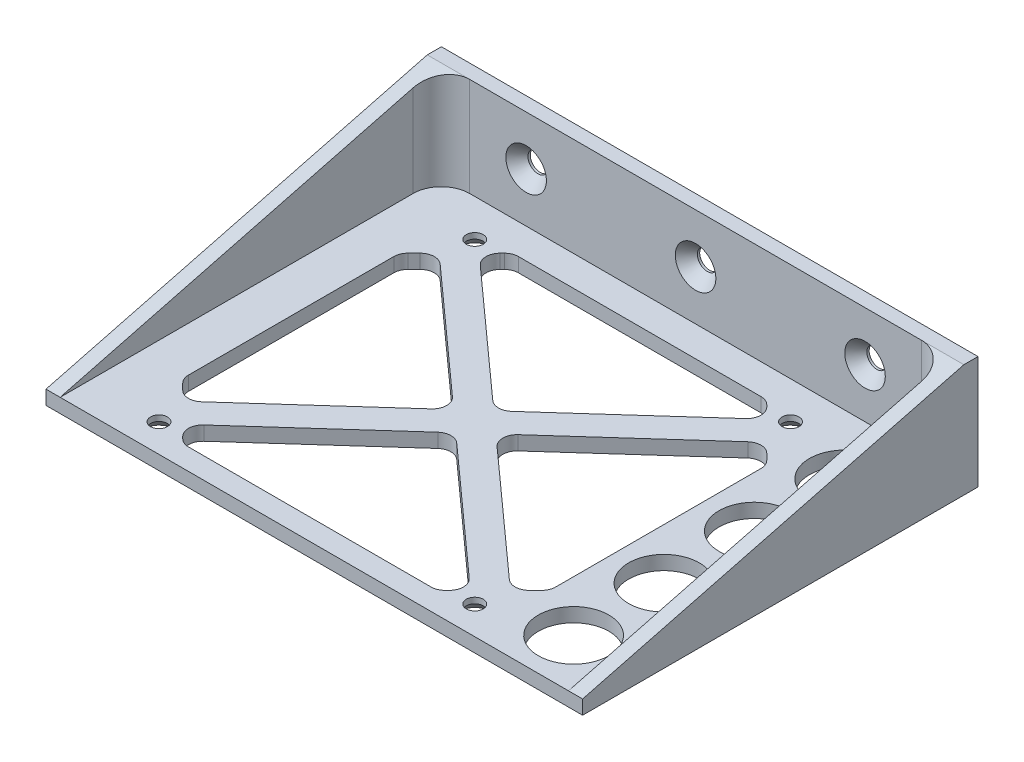
from build123d import *

# Parameters (mm, degrees)
SKETCH1_W                                     = 120.65
SKETCH1_H                                     = 88.9
BOSS_EXTRUDE1_DEPTH                           = 3.175
SKETCH2_W                                     = 120.65
SKETCH2_H                                     = 3.175
BOSS_EXTRUDE2_DEPTH                           = 22.225
CSK_FOR_6_FLAT_HEAD_MACHINE_SCREW1_AT_2_COUNT = 2
CSK_FOR_6_FLAT_HEAD_MACHINE_SCREW1_AT_2_PITCH = 71
CSK_FOR_6_FLAT_HEAD_MACHINE_SCREW1_AT_3_COUNT = 2
CSK_FOR_6_FLAT_HEAD_MACHINE_SCREW1_AT_3_PITCH = 100.409162928
CSK_FOR_6_FLAT_HEAD_MACHINE_SCREW1_AT_4_COUNT = 2
CSK_FOR_6_FLAT_HEAD_MACHINE_SCREW1_AT_4_PITCH = 71
CUT_EXTRUDE1_DEPTH                            = 80.120592294
FILLET2_R                                     = 3.175
BOSS_EXTRUDE3_DEPTH                           = 3.175
FILLET3_R                                     = 6.35
FILLET3_OF_MIRROR1_R                          = 6.35
CSK_FOR_8_FLAT_HEAD_SOCKET_CAP_SCREW1_A_COUNT = 2
CSK_FOR_8_FLAT_HEAD_SOCKET_CAP_SCREW1_A_PITCH = 76.2
CSK_FOR_8_FLAT_HEAD_SOCKET_CAP_SCRE_2_COUNT   = 2
CSK_FOR_8_FLAT_HEAD_SOCKET_CAP_SCRE_2_PITCH   = 38.1
CUT_EXTRUDE2_REACH                            = 80.159
SKETCH12_R                                    = 7.9375


with BuildPart() as part:
    # Sketch1 → Boss-Extrude1 (new body)
    with BuildSketch(Plane(origin=(0, 0, 0), x_dir=(1, 0, 0), z_dir=(0, 1, 0))):
        Rectangle(SKETCH1_W, SKETCH1_H)
    extrude(amount=BOSS_EXTRUDE1_DEPTH)

    # Sketch2 → Boss-Extrude2 (add)
    with BuildSketch(Plane(origin=(0, 3.175, 0), x_dir=(1, 0, 0), z_dir=(0, 1, 0))):
        with Locations((0, 42.8625)):
            Rectangle(SKETCH2_W, SKETCH2_H)
    extrude(amount=BOSS_EXTRUDE2_DEPTH)

    # Sketch4 → CSK for #6 Flat Head Machine Screw1 (revolve, cut)
    with BuildSketch(Plane(origin=(29.725, 0, 38.1), x_dir=(0, 0, -1), z_dir=(1, 0, 0))):
        Polygon((0, 0), (0, 3.175), (1.89865, 3.175), (1.89865, 1.891953401), (3.5433, 0), align=None)
    csk_for_6_flat_head_machine_screw1 = revolve(axis=Axis((29.725, -6.35, 38.1), (0, 1, 0)), mode=Mode.SUBTRACT)

    # CSK for #6 Flat Head Machine Screw1 at 2: CSK for #6 Flat Head Machine Screw1 ×2
    with Locations(*[(0, 0, -i * CSK_FOR_6_FLAT_HEAD_MACHINE_SCREW1_AT_2_PITCH) for i in range(1, CSK_FOR_6_FLAT_HEAD_MACHINE_SCREW1_AT_2_COUNT)]):
        add(csk_for_6_flat_head_machine_screw1, mode=Mode.SUBTRACT)

    # CSK for #6 Flat Head Machine Screw1 at 3: CSK for #6 Flat Head Machine Screw1 ×2
    with Locations(*[Vector(-0.7071067811865476, 0, -0.7071067811865476) * (i * CSK_FOR_6_FLAT_HEAD_MACHINE_SCREW1_AT_3_PITCH) for i in range(1, CSK_FOR_6_FLAT_HEAD_MACHINE_SCREW1_AT_3_COUNT)]):
        add(csk_for_6_flat_head_machine_screw1, mode=Mode.SUBTRACT)

    # CSK for #6 Flat Head Machine Screw1 at 4: CSK for #6 Flat Head Machine Screw1 ×2
    with Locations(*[(-i * CSK_FOR_6_FLAT_HEAD_MACHINE_SCREW1_AT_4_PITCH, 0, 0) for i in range(1, CSK_FOR_6_FLAT_HEAD_MACHINE_SCREW1_AT_4_COUNT)]):
        add(csk_for_6_flat_head_machine_screw1, mode=Mode.SUBTRACT)

    # Sketch6 → Cut-Extrude1 (cut, through all)
    with BuildSketch(Plane.XZ):
        Polygon((-47.05, -21.784), (-42.608645627, -26.225354373), (-10.525631341, 2.6), (-42.608645627, 31.425354373), (-47.05, 26.984), align=None)
        Polygon((-38.112099916, 35.921900084), (-5.775, 6.868259544), (26.562099916, 35.921900084), (22.8, 39.684), (-34.35, 39.684), align=None)
        Polygon((-1.024368659, 2.6), (31.058645627, -26.225354373), (35.5, -21.784), (35.5, 26.984), (31.058645627, 31.425354373), align=None)
        Polygon((-38.112099916, -30.721900084), (-5.775, -1.668259544), (26.562099916, -30.721900084), (22.8, -34.484), (-34.35, -34.484), align=None)
    extrude(amount=-CUT_EXTRUDE1_DEPTH, mode=Mode.SUBTRACT)

    # Fillet2
    fillet2_edges = [part.edges().sort_by_distance(p)[0] for p in [
        (31.058645627, 1.5875, -26.225354373),
        (-1.024368659, 1.5875, 2.6),
        (31.058645627, 1.5875, 31.425354373),
        (35.5, 1.5875, 26.984),
        (35.5, 1.5875, -21.784),
        (-38.112099916, 1.5875, -30.721900084),
        (-5.775, 1.5875, -1.668259544),
        (26.562099916, 1.5875, -30.721900084),
        (22.8, 1.5875, -34.484),
        (-34.35, 1.5875, -34.484),
        (-42.608645627, 1.5875, -26.225354373),
        (-47.05, 1.5875, -21.784),
        (-47.05, 1.5875, 26.984),
        (-42.608645627, 1.5875, 31.425354373),
        (-10.525631341, 1.5875, 2.6),
        (-5.775, 1.5875, 6.868259544),
        (-38.112099916, 1.5875, 35.921900084),
        (-34.35, 1.5875, 39.684),
        (22.8, 1.5875, 39.684),
        (26.562099916, 1.5875, 35.921900084),
    ]]
    fillet(fillet2_edges, radius=FILLET2_R)

    # Sketch9 → Boss-Extrude3 (add)
    with BuildSketch(Plane.ZY.offset(60.325)):
        Polygon((-41.275, 25.4), (44.45, 3.175), (-41.275, 3.175), align=None)
    boss_extrude3 = extrude(amount=-BOSS_EXTRUDE3_DEPTH)

    # Fillet3
    fillet3_edges = [part.edges().sort_by_distance(p)[0] for p in [
        (-57.15, 14.2875, -41.275),
    ]]
    fillet(fillet3_edges, radius=FILLET3_R)

    # Mirror1: Boss-Extrude3 across plane
    add(boss_extrude3.mirror(Plane(origin=(0, 0, 0), x_dir=(0, 0, 1), z_dir=(1, 0, 0))))

    # Fillet3 of Mirror1
    fillet3_of_mirror1_edges = [part.edges().sort_by_distance(p)[0] for p in [
        (57.15, 14.2875, -41.275),
    ]]
    fillet(fillet3_of_mirror1_edges, radius=FILLET3_OF_MIRROR1_R)

    # Sketch10 → CSK for #8 Flat Head Socket Cap Screw1 (revolve, cut)
    with BuildSketch(Plane(origin=(-38.1, 14.2875, -41.275), x_dir=(0, -1, 0), z_dir=(1, 0, 0))):
        Polygon((0, 0), (0, 3.175), (2.2479, 3.175), (2.2479, 2.658961536), (4.5593, 0), align=None)
    csk_for_8_flat_head_socket_cap_screw1 = revolve(axis=Axis((-38.1, 14.2875, -34.925), (0, 0, -1)), mode=Mode.SUBTRACT)

    # CSK for #8 Flat Head Socket Cap Screw1 a: CSK for #8 Flat Head Socket Cap Screw1 ×2
    with Locations(*[(i * CSK_FOR_8_FLAT_HEAD_SOCKET_CAP_SCREW1_A_PITCH, 0, 0) for i in range(1, CSK_FOR_8_FLAT_HEAD_SOCKET_CAP_SCREW1_A_COUNT)]):
        add(csk_for_8_flat_head_socket_cap_screw1, mode=Mode.SUBTRACT)

    # CSK for _8 Flat Head Socket Cap Scre 2: CSK for #8 Flat Head Socket Cap Screw1 ×2
    with Locations(*[(i * CSK_FOR_8_FLAT_HEAD_SOCKET_CAP_SCRE_2_PITCH, 0, 0) for i in range(1, CSK_FOR_8_FLAT_HEAD_SOCKET_CAP_SCRE_2_COUNT)]):
        add(csk_for_8_flat_head_socket_cap_screw1, mode=Mode.SUBTRACT)

    # Sketch12 → Cut-Extrude2 (cut, up to next)
    with BuildSketch(Plane(origin=(0, 3.175, 0), x_dir=(1, 0, 0), z_dir=(0, 1, 0)), mode=Mode.PRIVATE) as cut_extrude2_sk1:
        with Locations(Location((46.93, 27.88, 0), (0, 0, 270))):
            Circle(SKETCH12_R)
    cut_extrude2_tool1 = extrude(cut_extrude2_sk1.sketch, amount=-CUT_EXTRUDE2_REACH, mode=Mode.PRIVATE) & part.part
    # Sketch12 → Cut-Extrude2 (cut, up to next)
    with BuildSketch(Plane(origin=(0, 3.175, 0), x_dir=(1, 0, 0), z_dir=(0, 1, 0)), mode=Mode.PRIVATE) as cut_extrude2_sk2:
        with Locations(Location((46.93, 7.56, 0), (0, 0, 270))):
            Circle(SKETCH12_R)
    cut_extrude2_tool2 = extrude(cut_extrude2_sk2.sketch, amount=-CUT_EXTRUDE2_REACH, mode=Mode.PRIVATE) & part.part
    # Sketch12 → Cut-Extrude2 (cut, up to next)
    with BuildSketch(Plane(origin=(0, 3.175, 0), x_dir=(1, 0, 0), z_dir=(0, 1, 0)), mode=Mode.PRIVATE) as cut_extrude2_sk3:
        with Locations(Location((46.93, -12.76, 0), (0, 0, 270))):
            Circle(SKETCH12_R)
    cut_extrude2_tool3 = extrude(cut_extrude2_sk3.sketch, amount=-CUT_EXTRUDE2_REACH, mode=Mode.PRIVATE) & part.part
    # Sketch12 → Cut-Extrude2 (cut, up to next)
    with BuildSketch(Plane(origin=(0, 3.175, 0), x_dir=(1, 0, 0), z_dir=(0, 1, 0)), mode=Mode.PRIVATE) as cut_extrude2_sk4:
        with Locations(Location((46.93, -33.08, 0), (0, 0, 270))):
            Circle(SKETCH12_R)
    cut_extrude2_tool4 = extrude(cut_extrude2_sk4.sketch, amount=-CUT_EXTRUDE2_REACH, mode=Mode.PRIVATE) & part.part
    add(cut_extrude2_tool1.solids().sort_by_distance((46.93, 3.175, -27.88))[0], mode=Mode.SUBTRACT)
    add(cut_extrude2_tool2.solids().sort_by_distance((46.93, 3.175, -7.56))[0], mode=Mode.SUBTRACT)
    add(cut_extrude2_tool3.solids().sort_by_distance((46.93, 3.175, 12.76))[0], mode=Mode.SUBTRACT)
    add(cut_extrude2_tool4.solids().sort_by_distance((46.93, 3.175, 33.08))[0], mode=Mode.SUBTRACT)


solid = part.part
